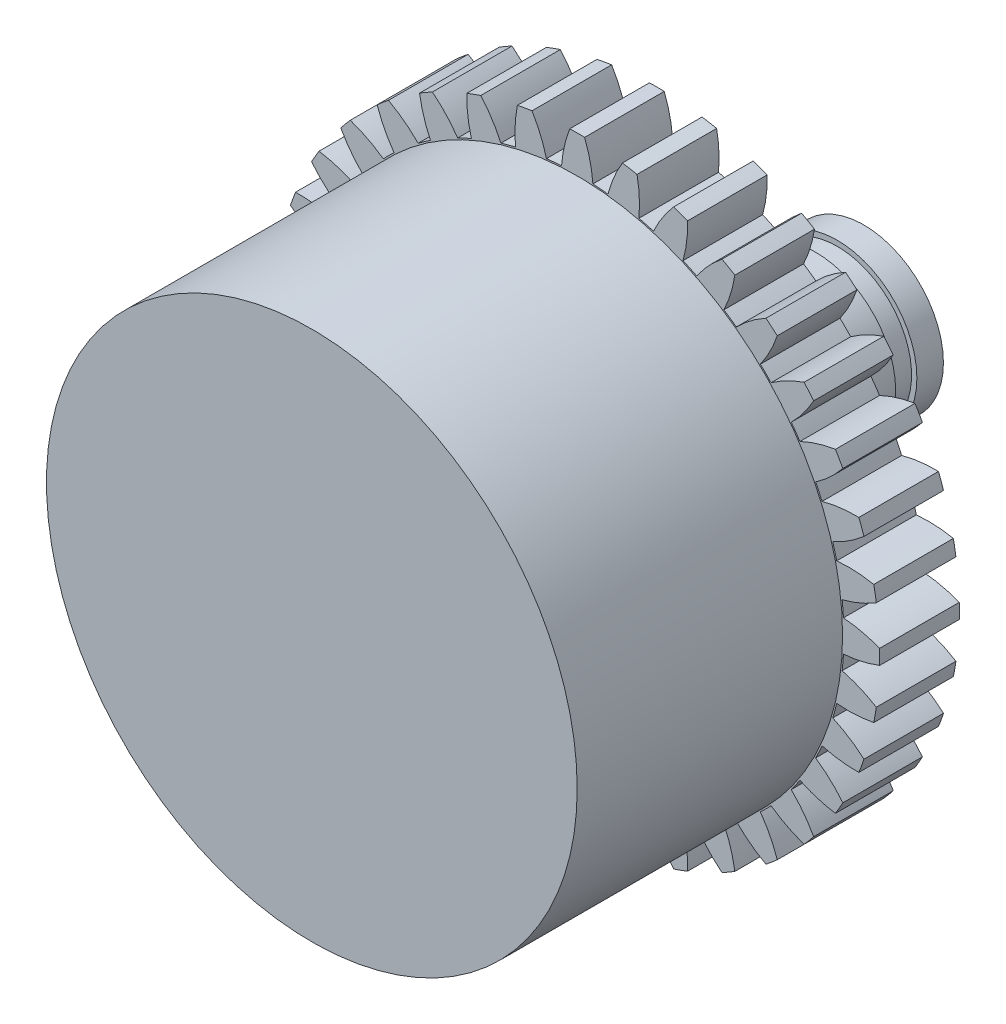
from build123d import *

# Parameters (mm, degrees)
SKETCH_1_R          = 5
EXTRUDE_1_DEPTH     = 5
SKETCH_2_R          = 1.5
EXTRUDE_2_DEPTH     = 5.4
SKETCH_3_R          = 2
EXTRUDE_3_DEPTH     = 2
SKETCH_4_R          = 0.79
CUT_EXTRUDE_1_DEPTH = 2
EXTRUDE_4_DEPTH     = 1.5
CUT_EXTRUDE_START   = 3
SKETCH_7_R          = 2
SKETCH_7_R_2        = 1.4
CUT_EXTRUDE_3_DEPTH = 0.4


with BuildPart() as part:
    # 스케치1 → 보스-돌출1 (new body)
    with BuildSketch(Plane.XY):
        Circle(SKETCH_1_R)
    extrude(amount=EXTRUDE_1_DEPTH)

    # 스케치2 → 보스-돌출2 (add)
    with BuildSketch(Plane(origin=(0, 0, 0), x_dir=(-1, 0, 0), z_dir=(0, 0, -1))):
        with Locations(Location((0, 0, 0), (0, 0, 180))):
            Circle(SKETCH_2_R)
    extrude(amount=EXTRUDE_2_DEPTH)

    # 스케치3 → 보스-돌출3 (add)
    with BuildSketch(Plane(origin=(0, 0, 0), x_dir=(-1, 0, 0), z_dir=(0, 0, -1))):
        with Locations(Location((0, 0, 0), (0, 0, 180))):
            Circle(SKETCH_3_R)
    extrude(amount=EXTRUDE_3_DEPTH)

    # 스케치4 → 컷-돌출1 (cut)
    with BuildSketch(Plane(origin=(0, 0, -5.4), x_dir=(-1, 0, 0), z_dir=(0, 0, -1))):
        Circle(SKETCH_4_R)
    extrude(amount=-CUT_EXTRUDE_1_DEPTH, mode=Mode.SUBTRACT)

    # 스케치5 → 보스-돌출4 (add)
    with BuildSketch(Plane(origin=(0, 0, 0), x_dir=(-1, 0, 0), z_dir=(0, 0, -1))):
        with BuildLine():
            ThreePointArc((-0.295754882, 5.016288872), (-0.243045211, 5.363052817), (-0.139875757, 5.698283494))
            ThreePointArc((-0.139875757, 5.698283494), (0, 5.7), (0.139875757, 5.698283494))
            ThreePointArc((0.139875757, 5.698283494), (0.243045211, 5.363052817), (0.295754882, 5.016288872))
            ThreePointArc((0.295754882, 5.016288872), (0.437957607, 5.005878358), (0.57980772, 4.991437469))
            ThreePointArc((0.57980772, 4.991437469), (0.69193154, 5.323780352), (0.851745815, 5.636002934))
            ThreePointArc((0.851745815, 5.636002934), (0.989794613, 5.613404192), (1.127247274, 5.587424593))
            ThreePointArc((1.127247274, 5.587424593), (1.170637157, 5.239371636), (1.162331123, 4.888722876))
            ThreePointArc((1.162331123, 4.888722876), (1.300565702, 4.853777277), (1.437753158, 4.814923764))
            ThreePointArc((1.437753158, 4.814923764), (1.605884302, 5.122747515), (1.817487521, 5.402475276))
            ThreePointArc((1.817487521, 5.402475276), (1.949514817, 5.356247938), (2.080367954, 5.306794624))
            ThreePointArc((2.080367954, 5.306794624), (2.062659884, 4.956494799), (1.99359052, 4.61261551))
            ThreePointArc((1.99359052, 4.61261551), (2.123656765, 4.55419663), (2.252013195, 4.492111037))
            ThreePointArc((2.252013195, 4.492111037), (2.471043081, 4.766062587), (2.728005788, 5.004796142))
            ThreePointArc((2.728005788, 5.004796142), (2.85, 4.936344802), (2.970277706, 4.864920385))
            ThreePointArc((2.970277706, 4.864920385), (2.892009736, 4.523017376), (2.764275678, 4.196356155))
            ThreePointArc((2.764275678, 4.196356155), (2.882221593, 4.116239023), (2.997846949, 4.03280779))
            ThreePointArc((2.997846949, 4.03280779), (3.261120467, 4.264563259), (3.55563498, 4.455048809))
            ThreePointArc((3.55563498, 4.455048809), (3.663889375, 4.366453326), (3.769937072, 4.275228002))
            ThreePointArc((3.769937072, 4.275228002), (3.633487334, 3.952110358), (3.450969718, 3.652592642))
            ThreePointArc((3.450969718, 3.652592642), (3.553211575, 3.553211575), (3.652592642, 3.450969718))
            ThreePointArc((3.652592642, 3.450969718), (3.952110358, 3.633487334), (4.275228002, 3.769937072))
            ThreePointArc((4.275228002, 3.769937072), (4.366453326, 3.663889375), (4.455048809, 3.55563498))
            ThreePointArc((4.455048809, 3.55563498), (4.264563259, 3.261120467), (4.03280779, 2.997846949))
            ThreePointArc((4.03280779, 2.997846949), (4.116239023, 2.882221593), (4.196356155, 2.764275678))
            ThreePointArc((4.196356155, 2.764275678), (4.523017376, 2.892009736), (4.864920385, 2.970277706))
            ThreePointArc((4.864920385, 2.970277706), (4.936344802, 2.85), (5.004796142, 2.728005788))
            ThreePointArc((5.004796142, 2.728005788), (4.766062587, 2.471043081), (4.492111037, 2.252013195))
            ThreePointArc((4.492111037, 2.252013195), (4.55419663, 2.123656765), (4.61261551, 1.99359052))
            ThreePointArc((4.61261551, 1.99359052), (4.956494799, 2.062659884), (5.306794624, 2.080367954))
            ThreePointArc((5.306794624, 2.080367954), (5.356247938, 1.949514817), (5.402475276, 1.817487521))
            ThreePointArc((5.402475276, 1.817487521), (5.122747515, 1.605884302), (4.814923764, 1.437753158))
            ThreePointArc((4.814923764, 1.437753158), (4.853777277, 1.300565702), (4.888722876, 1.162331123))
            ThreePointArc((4.888722876, 1.162331123), (5.239371636, 1.170637157), (5.587424593, 1.127247274))
            ThreePointArc((5.587424593, 1.127247274), (5.613404192, 0.989794613), (5.636002934, 0.851745815))
            ThreePointArc((5.636002934, 0.851745815), (5.323780352, 0.69193154), (4.991437469, 0.57980772))
            ThreePointArc((4.991437469, 0.57980772), (5.005878358, 0.437957607), (5.016288872, 0.295754882))
            ThreePointArc((5.016288872, 0.295754882), (5.363052817, 0.243045211), (5.698283494, 0.139875757))
            ThreePointArc((5.698283494, 0.139875757), (5.7, 0), (5.698283494, -0.139875757))
            ThreePointArc((5.698283494, -0.139875757), (5.363052817, -0.243045211), (5.016288872, -0.295754882))
            ThreePointArc((5.016288872, -0.295754882), (5.005878358, -0.437957607), (4.991437469, -0.57980772))
            ThreePointArc((4.991437469, -0.57980772), (5.323780352, -0.69193154), (5.636002934, -0.851745815))
            ThreePointArc((5.636002934, -0.851745815), (5.613404192, -0.989794613), (5.587424593, -1.127247274))
            ThreePointArc((5.587424593, -1.127247274), (5.239371636, -1.170637157), (4.888722876, -1.162331123))
            ThreePointArc((4.888722876, -1.162331123), (4.853777277, -1.300565702), (4.814923764, -1.437753158))
            ThreePointArc((4.814923764, -1.437753158), (5.122747515, -1.605884302), (5.402475276, -1.817487521))
            ThreePointArc((5.402475276, -1.817487521), (5.356247938, -1.949514817), (5.306794624, -2.080367954))
            ThreePointArc((5.306794624, -2.080367954), (4.956494799, -2.062659884), (4.61261551, -1.99359052))
            ThreePointArc((4.61261551, -1.99359052), (4.55419663, -2.123656765), (4.492111037, -2.252013195))
            ThreePointArc((4.492111037, -2.252013195), (4.766062587, -2.471043081), (5.004796142, -2.728005788))
            ThreePointArc((5.004796142, -2.728005788), (4.936344802, -2.85), (4.864920385, -2.970277706))
            ThreePointArc((4.864920385, -2.970277706), (4.523017376, -2.892009736), (4.196356155, -2.764275678))
            ThreePointArc((4.196356155, -2.764275678), (4.116239023, -2.882221593), (4.03280779, -2.997846949))
            ThreePointArc((4.03280779, -2.997846949), (4.264563259, -3.261120467), (4.455048809, -3.55563498))
            ThreePointArc((4.455048809, -3.55563498), (4.366453326, -3.663889375), (4.275228002, -3.769937072))
            ThreePointArc((4.275228002, -3.769937072), (3.952110358, -3.633487334), (3.652592642, -3.450969718))
            ThreePointArc((3.652592642, -3.450969718), (3.553211575, -3.553211575), (3.450969718, -3.652592642))
            ThreePointArc((3.450969718, -3.652592642), (3.633487334, -3.952110358), (3.769937072, -4.275228002))
            ThreePointArc((3.769937072, -4.275228002), (3.663889375, -4.366453326), (3.55563498, -4.455048809))
            ThreePointArc((3.55563498, -4.455048809), (3.261120467, -4.264563259), (2.997846949, -4.03280779))
            ThreePointArc((2.997846949, -4.03280779), (2.882221593, -4.116239023), (2.764275678, -4.196356155))
            ThreePointArc((2.764275678, -4.196356155), (2.892009736, -4.523017376), (2.970277706, -4.864920385))
            ThreePointArc((2.970277706, -4.864920385), (2.85, -4.936344802), (2.728005788, -5.004796142))
            ThreePointArc((2.728005788, -5.004796142), (2.471043081, -4.766062587), (2.252013195, -4.492111037))
            ThreePointArc((2.252013195, -4.492111037), (2.123656765, -4.55419663), (1.99359052, -4.61261551))
            ThreePointArc((1.99359052, -4.61261551), (2.062659884, -4.956494799), (2.080367954, -5.306794624))
            ThreePointArc((2.080367954, -5.306794624), (1.949514817, -5.356247938), (1.817487521, -5.402475276))
            ThreePointArc((1.817487521, -5.402475276), (1.605884302, -5.122747515), (1.437753158, -4.814923764))
            ThreePointArc((1.437753158, -4.814923764), (1.300565702, -4.853777277), (1.162331123, -4.888722876))
            ThreePointArc((1.162331123, -4.888722876), (1.170637157, -5.239371636), (1.127247274, -5.587424593))
            ThreePointArc((1.127247274, -5.587424593), (0.989794613, -5.613404192), (0.851745815, -5.636002934))
            ThreePointArc((0.851745815, -5.636002934), (0.69193154, -5.323780352), (0.57980772, -4.991437469))
            ThreePointArc((0.57980772, -4.991437469), (0.437957607, -5.005878358), (0.295754882, -5.016288872))
            ThreePointArc((0.295754882, -5.016288872), (0.243045211, -5.363052817), (0.139875757, -5.698283494))
            ThreePointArc((0.139875757, -5.698283494), (0, -5.7), (-0.139875757, -5.698283494))
            ThreePointArc((-0.139875757, -5.698283494), (-0.243045211, -5.363052817), (-0.295754882, -5.016288872))
            ThreePointArc((-0.295754882, -5.016288872), (-0.437957607, -5.005878358), (-0.57980772, -4.991437469))
            ThreePointArc((-0.57980772, -4.991437469), (-0.69193154, -5.323780352), (-0.851745815, -5.636002934))
            ThreePointArc((-0.851745815, -5.636002934), (-0.989794613, -5.613404192), (-1.127247274, -5.587424593))
            ThreePointArc((-1.127247274, -5.587424593), (-1.170637157, -5.239371636), (-1.162331123, -4.888722876))
            ThreePointArc((-1.162331123, -4.888722876), (-1.300565702, -4.853777277), (-1.437753158, -4.814923764))
            ThreePointArc((-1.437753158, -4.814923764), (-1.605884302, -5.122747515), (-1.817487521, -5.402475276))
            ThreePointArc((-1.817487521, -5.402475276), (-1.949514817, -5.356247938), (-2.080367954, -5.306794624))
            ThreePointArc((-2.080367954, -5.306794624), (-2.062659884, -4.956494799), (-1.99359052, -4.61261551))
            ThreePointArc((-1.99359052, -4.61261551), (-2.123656765, -4.55419663), (-2.252013195, -4.492111037))
            ThreePointArc((-2.252013195, -4.492111037), (-2.471043081, -4.766062587), (-2.728005788, -5.004796142))
            ThreePointArc((-2.728005788, -5.004796142), (-2.85, -4.936344802), (-2.970277706, -4.864920385))
            ThreePointArc((-2.970277706, -4.864920385), (-2.892009736, -4.523017376), (-2.764275678, -4.196356155))
            ThreePointArc((-2.764275678, -4.196356155), (-2.882221593, -4.116239023), (-2.997846949, -4.03280779))
            ThreePointArc((-2.997846949, -4.03280779), (-3.261120467, -4.264563259), (-3.55563498, -4.455048809))
            ThreePointArc((-3.55563498, -4.455048809), (-3.663889375, -4.366453326), (-3.769937072, -4.275228002))
            ThreePointArc((-3.769937072, -4.275228002), (-3.633487334, -3.952110358), (-3.450969718, -3.652592642))
            ThreePointArc((-3.450969718, -3.652592642), (-3.553211575, -3.553211575), (-3.652592642, -3.450969718))
            ThreePointArc((-3.652592642, -3.450969718), (-3.952110358, -3.633487334), (-4.275228002, -3.769937072))
            ThreePointArc((-4.275228002, -3.769937072), (-4.366453326, -3.663889375), (-4.455048809, -3.55563498))
            ThreePointArc((-4.455048809, -3.55563498), (-4.264563259, -3.261120467), (-4.03280779, -2.997846949))
            ThreePointArc((-4.03280779, -2.997846949), (-4.116239023, -2.882221593), (-4.196356155, -2.764275678))
            ThreePointArc((-4.196356155, -2.764275678), (-4.523017376, -2.892009736), (-4.864920385, -2.970277706))
            ThreePointArc((-4.864920385, -2.970277706), (-4.936344802, -2.85), (-5.004796142, -2.728005788))
            ThreePointArc((-5.004796142, -2.728005788), (-4.766062587, -2.471043081), (-4.492111037, -2.252013195))
            ThreePointArc((-4.492111037, -2.252013195), (-4.55419663, -2.123656765), (-4.61261551, -1.99359052))
            ThreePointArc((-4.61261551, -1.99359052), (-4.956494799, -2.062659884), (-5.306794624, -2.080367954))
            ThreePointArc((-5.306794624, -2.080367954), (-5.356247938, -1.949514817), (-5.402475276, -1.817487521))
            ThreePointArc((-5.402475276, -1.817487521), (-5.122747515, -1.605884302), (-4.814923764, -1.437753158))
            ThreePointArc((-4.814923764, -1.437753158), (-4.853777277, -1.300565702), (-4.888722876, -1.162331123))
            ThreePointArc((-4.888722876, -1.162331123), (-5.239371636, -1.170637157), (-5.587424593, -1.127247274))
            ThreePointArc((-5.587424593, -1.127247274), (-5.613404192, -0.989794613), (-5.636002934, -0.851745815))
            ThreePointArc((-5.636002934, -0.851745815), (-5.323780352, -0.69193154), (-4.991437469, -0.57980772))
            ThreePointArc((-4.991437469, -0.57980772), (-5.005878358, -0.437957607), (-5.016288872, -0.295754882))
            ThreePointArc((-5.016288872, -0.295754882), (-5.363052817, -0.243045211), (-5.698283494, -0.139875757))
            ThreePointArc((-5.698283494, -0.139875757), (-5.7, 0), (-5.698283494, 0.139875757))
            ThreePointArc((-5.698283494, 0.139875757), (-5.363052817, 0.243045211), (-5.016288872, 0.295754882))
            ThreePointArc((-5.016288872, 0.295754882), (-5.005878358, 0.437957607), (-4.991437469, 0.57980772))
            ThreePointArc((-4.991437469, 0.57980772), (-5.323780352, 0.69193154), (-5.636002934, 0.851745815))
            ThreePointArc((-5.636002934, 0.851745815), (-5.613404192, 0.989794613), (-5.587424593, 1.127247274))
            ThreePointArc((-5.587424593, 1.127247274), (-5.239371636, 1.170637157), (-4.888722876, 1.162331123))
            ThreePointArc((-4.888722876, 1.162331123), (-4.853777277, 1.300565702), (-4.814923764, 1.437753158))
            ThreePointArc((-4.814923764, 1.437753158), (-5.122747515, 1.605884302), (-5.402475276, 1.817487521))
            ThreePointArc((-5.402475276, 1.817487521), (-5.356247938, 1.949514817), (-5.306794624, 2.080367954))
            ThreePointArc((-5.306794624, 2.080367954), (-4.956494799, 2.062659884), (-4.61261551, 1.99359052))
            ThreePointArc((-4.61261551, 1.99359052), (-4.55419663, 2.123656765), (-4.492111037, 2.252013195))
            ThreePointArc((-4.492111037, 2.252013195), (-4.766062587, 2.471043081), (-5.004796142, 2.728005788))
            ThreePointArc((-5.004796142, 2.728005788), (-4.936344802, 2.85), (-4.864920385, 2.970277706))
            ThreePointArc((-4.864920385, 2.970277706), (-4.523017376, 2.892009736), (-4.196356155, 2.764275678))
            ThreePointArc((-4.196356155, 2.764275678), (-4.116239023, 2.882221593), (-4.03280779, 2.997846949))
            ThreePointArc((-4.03280779, 2.997846949), (-4.264563259, 3.261120467), (-4.455048809, 3.55563498))
            ThreePointArc((-4.455048809, 3.55563498), (-4.366453326, 3.663889375), (-4.275228002, 3.769937072))
            ThreePointArc((-4.275228002, 3.769937072), (-3.952110358, 3.633487334), (-3.652592642, 3.450969718))
            ThreePointArc((-3.652592642, 3.450969718), (-3.553211575, 3.553211575), (-3.450969718, 3.652592642))
            ThreePointArc((-3.450969718, 3.652592642), (-3.633487334, 3.952110358), (-3.769937072, 4.275228002))
            ThreePointArc((-3.769937072, 4.275228002), (-3.663889375, 4.366453326), (-3.55563498, 4.455048809))
            ThreePointArc((-3.55563498, 4.455048809), (-3.261120467, 4.264563259), (-2.997846949, 4.03280779))
            ThreePointArc((-2.997846949, 4.03280779), (-2.882221593, 4.116239023), (-2.764275678, 4.196356155))
            ThreePointArc((-2.764275678, 4.196356155), (-2.892009736, 4.523017376), (-2.970277706, 4.864920385))
            ThreePointArc((-2.970277706, 4.864920385), (-2.85, 4.936344802), (-2.728005788, 5.004796142))
            ThreePointArc((-2.728005788, 5.004796142), (-2.471043081, 4.766062587), (-2.252013195, 4.492111037))
            ThreePointArc((-2.252013195, 4.492111037), (-2.123656765, 4.55419663), (-1.99359052, 4.61261551))
            ThreePointArc((-1.99359052, 4.61261551), (-2.062659884, 4.956494799), (-2.080367954, 5.306794624))
            ThreePointArc((-2.080367954, 5.306794624), (-1.949514817, 5.356247938), (-1.817487521, 5.402475276))
            ThreePointArc((-1.817487521, 5.402475276), (-1.605884302, 5.122747515), (-1.437753158, 4.814923764))
            ThreePointArc((-1.437753158, 4.814923764), (-1.300565702, 4.853777277), (-1.162331123, 4.888722876))
            ThreePointArc((-1.162331123, 4.888722876), (-1.170637157, 5.239371636), (-1.127247274, 5.587424593))
            ThreePointArc((-1.127247274, 5.587424593), (-0.989794613, 5.613404192), (-0.851745815, 5.636002934))
            ThreePointArc((-0.851745815, 5.636002934), (-0.69193154, 5.323780352), (-0.57980772, 4.991437469))
            ThreePointArc((-0.57980772, 4.991437469), (-0.437957607, 5.005878358), (-0.295754882, 5.016288872))
        make_face()
    extrude(amount=EXTRUDE_4_DEPTH)

    # 스케치7 → 컷-돌출3 (cut)
    with BuildSketch(Plane(origin=(0, 0, -1.5), x_dir=(-1, 0, 0), z_dir=(0, 0, -1)).offset(CUT_EXTRUDE_START)):
        with Locations(Location((0, 0, 0), (0, 0, 180))):
            Circle(SKETCH_7_R)
        Circle(SKETCH_7_R_2, mode=Mode.SUBTRACT)
    extrude(amount=CUT_EXTRUDE_3_DEPTH, mode=Mode.SUBTRACT)


solid = part.part
